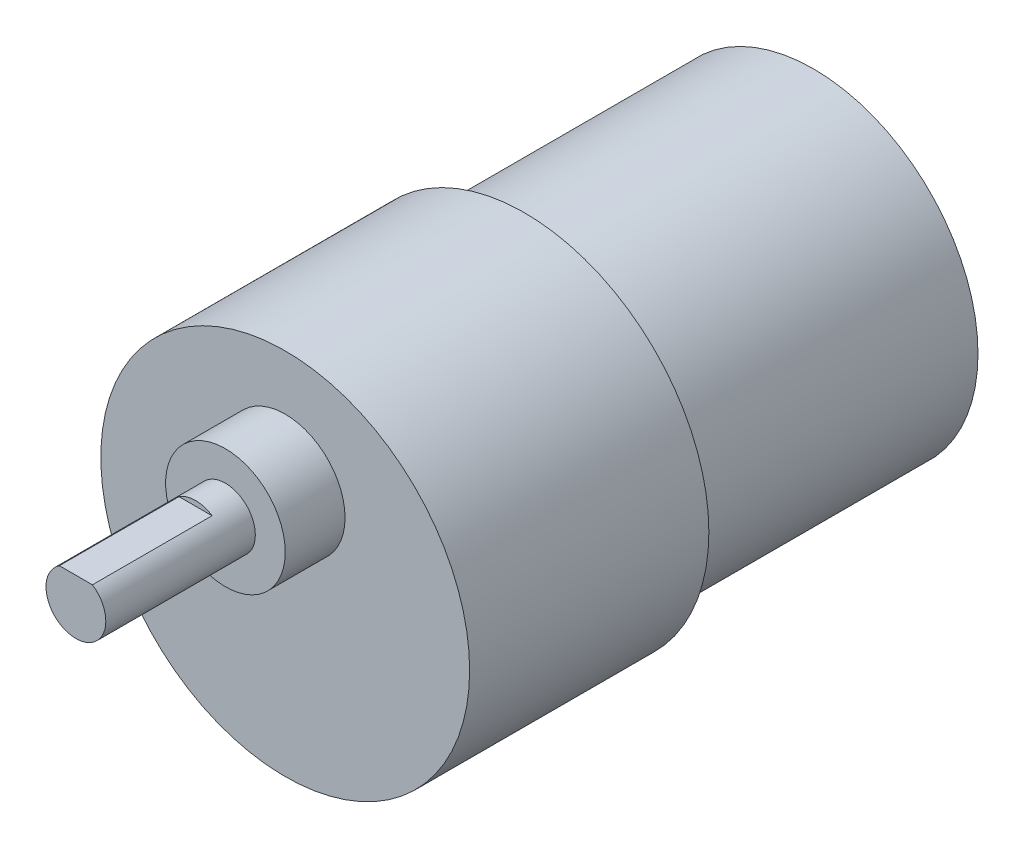
from build123d import *

# Parameters (mm, degrees)
SKIZZE1_R                       = 16.5
AUFSATZ_LINEAR_AUSTRAGEN1_DEPTH = 29
SKIZZE2_R                       = 18.5
AUFSATZ_LINEAR_AUSTRAGEN2_DEPTH = 24
SKIZZE3_R                       = 6
AUFSATZ_LINEAR_AUSTRAGEN3_DEPTH = 6
SKIZZE4_R                       = 3
AUFSATZ_LINEAR_AUSTRAGEN4_DEPTH = 15
SKIZZE5_W                       = 5.984100999
SKIZZE5_H                       = 2.255405848
SCHNITT_LINEAR_AUSTRAGEN1_DEPTH = 12


with BuildPart() as part:
    # Skizze1 → Aufsatz-Linear austragen1 (new body)
    with BuildSketch(Plane(origin=(0, 0, 0), x_dir=(0, 1, 0), z_dir=(0, 0, 1))):
        with Locations(Location((0, 0, 0), (0, 0, 90))):
            Circle(SKIZZE1_R)
    extrude(amount=AUFSATZ_LINEAR_AUSTRAGEN1_DEPTH)


with BuildPart() as body_2:
    # Skizze2 → Aufsatz-Linear austragen2 (new body)
    with BuildSketch(Plane.XY.offset(29)):
        Circle(SKIZZE2_R)
    extrude(amount=AUFSATZ_LINEAR_AUSTRAGEN2_DEPTH)


with BuildPart() as body_3:
    # Skizze3 → Aufsatz-Linear austragen3 (new body)
    with BuildSketch(Plane.XY.offset(53)):
        with Locations((0, 7)):
            Circle(SKIZZE3_R)
    extrude(amount=AUFSATZ_LINEAR_AUSTRAGEN3_DEPTH)


with BuildPart() as body_4:
    # Skizze4 → Aufsatz-Linear austragen4 (new body)
    with BuildSketch(Plane.XY.offset(59)):
        with Locations((0, 7)):
            Circle(SKIZZE4_R)
    extrude(amount=AUFSATZ_LINEAR_AUSTRAGEN4_DEPTH)

    # Skizze5 → Schnitt-Linear austragen1 (cut)
    with BuildSketch(Plane.XY.offset(74)):
        with Locations((0.183083145, 10.627702924)):
            Rectangle(SKIZZE5_W, SKIZZE5_H)
    extrude(amount=-SCHNITT_LINEAR_AUSTRAGEN1_DEPTH, mode=Mode.SUBTRACT)


solid = Compound([part.part, body_2.part, body_3.part, body_4.part])
